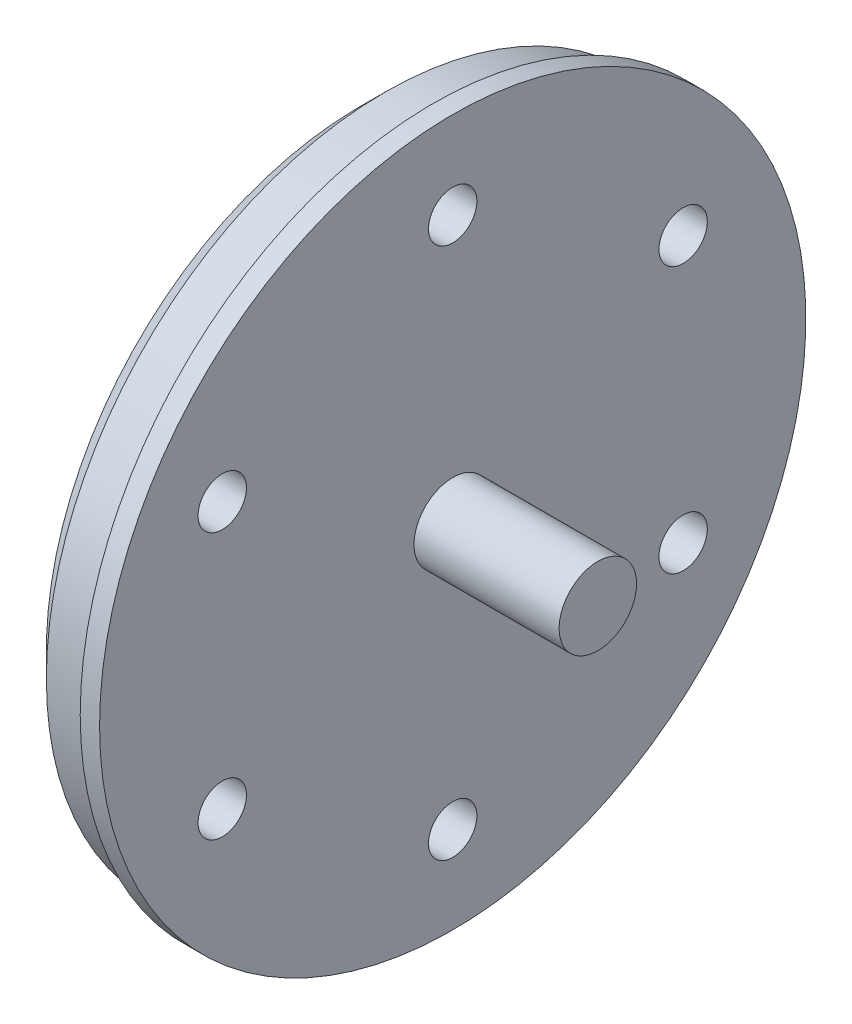
from build123d import *

# Parameters (mm, degrees)
SKETCH1_R           = 35
BOSS_EXTRUDE1_DEPTH = 9.5
SKETCH2_R           = 4
BOSS_EXTRUDE2_DEPTH = 15
SKETCH3_R           = 36.5
BOSS_EXTRUDE3_DEPTH = 2
SKETCH4_R           = 2.5
CUT_EXTRUDE1_DEPTH  = 17.5
SKETCH5_R           = 20
CUT_EXTRUDE2_DEPTH  = 7.5
CHAMFER1_SIZE       = 2.5


with BuildPart() as part:
    # Sketch1 → Boss-Extrude1 (new body)
    with BuildSketch(Plane(origin=(0, 0, 0), x_dir=(0, 0, -1), z_dir=(1, 0, 0))):
        Circle(SKETCH1_R)
    extrude(amount=BOSS_EXTRUDE1_DEPTH)

    # Sketch2 → Boss-Extrude2 (add)
    with BuildSketch(Plane(origin=(9.5, 0, 0), x_dir=(0, 0, -1), z_dir=(1, 0, 0))):
        Circle(SKETCH2_R)
    extrude(amount=BOSS_EXTRUDE2_DEPTH)

    # Sketch3 → Boss-Extrude3 (add)
    with BuildSketch(Plane.ZY.offset(-9.5)):
        Circle(SKETCH3_R)
    extrude(amount=BOSS_EXTRUDE3_DEPTH)

    # Sketch4 → Cut-Extrude1 (cut)
    with BuildSketch(Plane.ZY):
        with Locations((0, 27.5)):
            Circle(SKETCH4_R)
        with Locations((23.815698604, 13.75)):
            Circle(SKETCH4_R)
        with Locations((23.815698604, -13.75)):
            Circle(SKETCH4_R)
        with Locations((0, -27.5)):
            Circle(SKETCH4_R)
        with Locations((-23.815698604, -13.75)):
            Circle(SKETCH4_R)
        with Locations((-23.815698604, 13.75)):
            Circle(SKETCH4_R)
    extrude(amount=-CUT_EXTRUDE1_DEPTH, mode=Mode.SUBTRACT)

    # Sketch5 → Cut-Extrude2 (cut)
    with BuildSketch(Plane.ZY):
        Circle(SKETCH5_R)
    extrude(amount=-CUT_EXTRUDE2_DEPTH, mode=Mode.SUBTRACT)

    # Chamfer1
    chamfer1_edges = [part.edges().sort_by_distance(p)[0] for p in [
        (0, 0, 35),
        (0, 0, -20),
        (7.5, 0, -20),
    ]]
    chamfer(chamfer1_edges, length=CHAMFER1_SIZE)


solid = part.part
